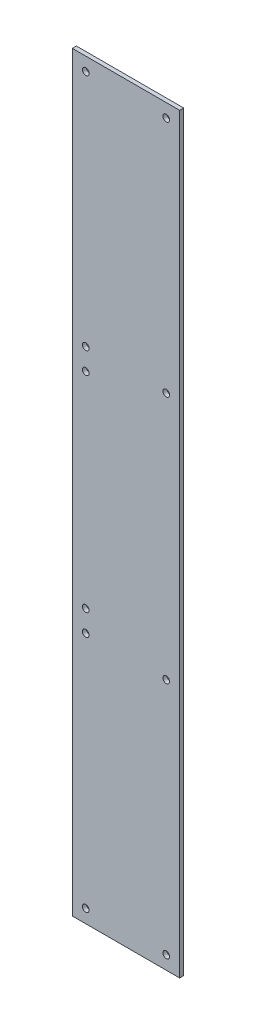
from build123d import *

# Parameters (mm, degrees)
SKETCH1_W               = 80
SKETCH1_H               = 560
BOSS_EXTRUDE1_DEPTH     = 3
CUT_EXTRUDE1_DEPTH      = 479.090444074
CUT_EXTRUDE1_DEPTH_BACK = 479.090444074
SKETCH2_R               = 2.5


with BuildPart() as part:
    # Sketch1 → Boss-Extrude1 (new body)
    with BuildSketch(Plane.XY):
        with Locations((5.641025641, -195.897435897)):
            Rectangle(SKETCH1_W, SKETCH1_H)
    extrude(amount=BOSS_EXTRUDE1_DEPTH)

    # Sketch2 → Cut-Extrude1 (cut, two sides: drawn at the far end of the back side and taken through both)
    with BuildSketch(Plane.XY.offset(3).offset(-CUT_EXTRUDE1_DEPTH_BACK)):
        with Locations((-24.358974359, 74.102564103)):
            Circle(SKETCH2_R)
        with Locations((35.641025641, 74.102564103)):
            Circle(SKETCH2_R)
        with Locations((-24.358974359, -465.897435897)):
            Circle(SKETCH2_R)
        with Locations((35.641025641, -465.897435897)):
            Circle(SKETCH2_R)
        with Locations((-24.358974359, -103.397435897)):
            Circle(SKETCH2_R)
        with Locations((-24.358974359, -288.397435897)):
            Circle(SKETCH2_R)
        with Locations((-24.358974359, -272.397435897)):
            Circle(SKETCH2_R)
        with Locations((-24.358974359, -119.397435897)):
            Circle(SKETCH2_R)
        with Locations((35.641025641, -103.397435897)):
            Circle(SKETCH2_R)
        with Locations((35.641025641, -288.397435897)):
            Circle(SKETCH2_R)
    extrude(amount=CUT_EXTRUDE1_DEPTH + CUT_EXTRUDE1_DEPTH_BACK, mode=Mode.SUBTRACT)


solid = part.part
